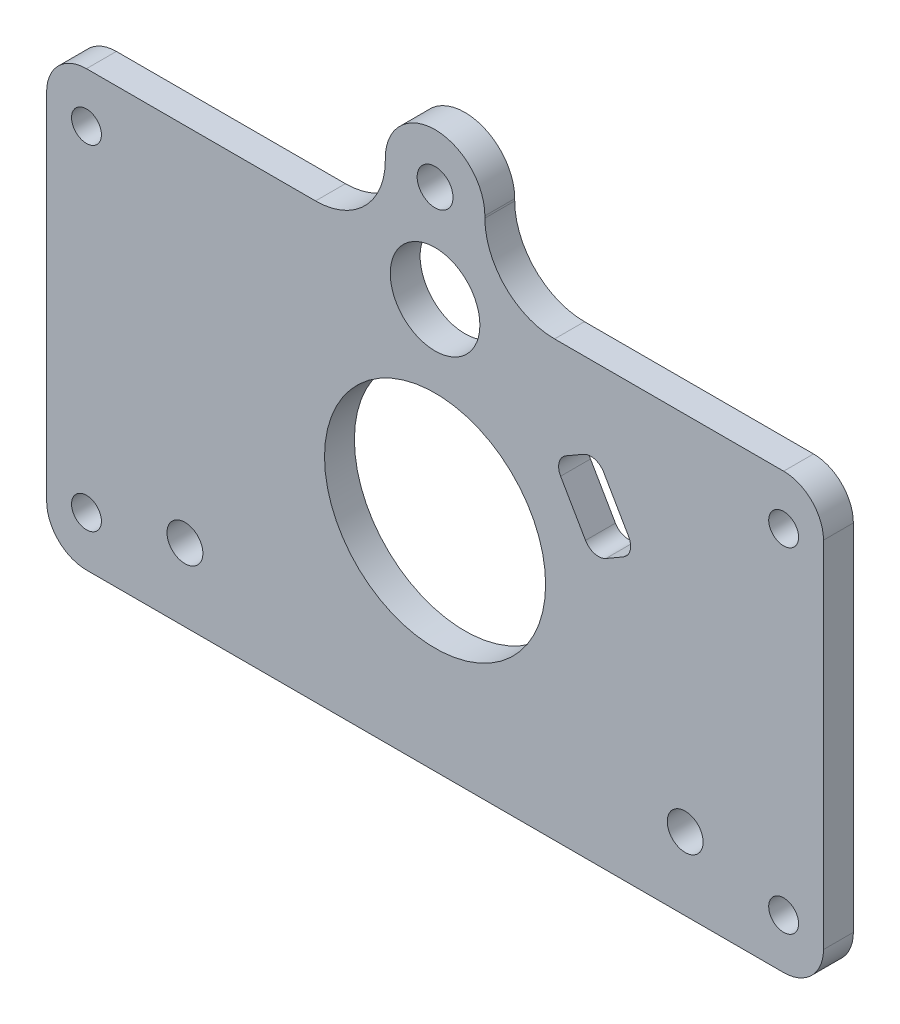
from build123d import *

# Parameters (mm, degrees)
SKETCH_1_R      = 11.1
SKETCH_1_R_2    = 1.8
SKETCH_1_R_3    = 4.5
SKETCH_1_R_4    = 1.5
EXTRUDE_1_DEPTH = 3
FILLET_1_R      = 1.5
FILLET_2_R      = 7
FILLET_3_R      = 4


with BuildPart() as part:
    # 草图1 → 凸台-拉伸1 (new body)
    with BuildSketch(Plane.XY):
        with BuildLine():
            Line((-5, 21.8), (-5, 29))
            ThreePointArc((-5, 29), (0, 34), (5, 29))
            Line((5, 29), (5, 21.8))
            Line((5, 21.8), (39, 21.8))
            Line((39, 21.8), (39, -21.8))
            Line((39, -21.8), (-39, -21.8))
            Line((-39, -21.8), (-39, 21.8))
            Line((-39, 21.8), (-5, 21.8))
        make_face()
        Circle(SKETCH_1_R, mode=Mode.SUBTRACT)
        with Locations((0, 29)):
            Circle(SKETCH_1_R_2, mode=Mode.SUBTRACT)
        with Locations((25.11473671, -14.5)):
            Circle(SKETCH_1_R_2, mode=Mode.SUBTRACT)
        with Locations((-25.11473671, -14.5)):
            Circle(SKETCH_1_R_2, mode=Mode.SUBTRACT)
        with Locations((0, 19.25)):
            Circle(SKETCH_1_R_3, mode=Mode.SUBTRACT)
        with Locations((35, 16.8)):
            Circle(SKETCH_1_R_4, mode=Mode.SUBTRACT)
        with Locations((35, -16.8)):
            Circle(SKETCH_1_R_4, mode=Mode.SUBTRACT)
        with Locations((-35, 16.8)):
            Circle(SKETCH_1_R_4, mode=Mode.SUBTRACT)
        with Locations((-35, -16.8)):
            Circle(SKETCH_1_R_4, mode=Mode.SUBTRACT)
        Polygon((11.856406461, 11.464101615), (15.856406461, 4.535898385), (20.186533479, 7.035898385), (16.186533479, 13.964101615), align=None, mode=Mode.SUBTRACT)
    extrude(amount=EXTRUDE_1_DEPTH)

    # 圆角1
    fillet_1_edges = [part.edges().sort_by_distance(p)[0] for p in [
        (16.186533479, 13.964101615, 1.5),
        (11.856406461, 11.464101615, 1.5),
        (15.856406461, 4.535898385, 1.5),
        (20.186533479, 7.035898385, 1.5),
    ]]
    fillet(fillet_1_edges, radius=FILLET_1_R)

    # 圆角2
    fillet_2_edges = [part.edges().sort_by_distance(p)[0] for p in [
        (-5, 21.8, 1.5),
        (5, 21.8, 1.5),
    ]]
    fillet(fillet_2_edges, radius=FILLET_2_R)

    # 圆角3
    fillet_3_edges = [part.edges().sort_by_distance(p)[0] for p in [
        (39, 21.8, 1.5),
        (39, -21.8, 1.5),
        (-39, -21.8, 1.5),
        (-39, 21.8, 1.5),
    ]]
    fillet(fillet_3_edges, radius=FILLET_3_R)


solid = part.part
